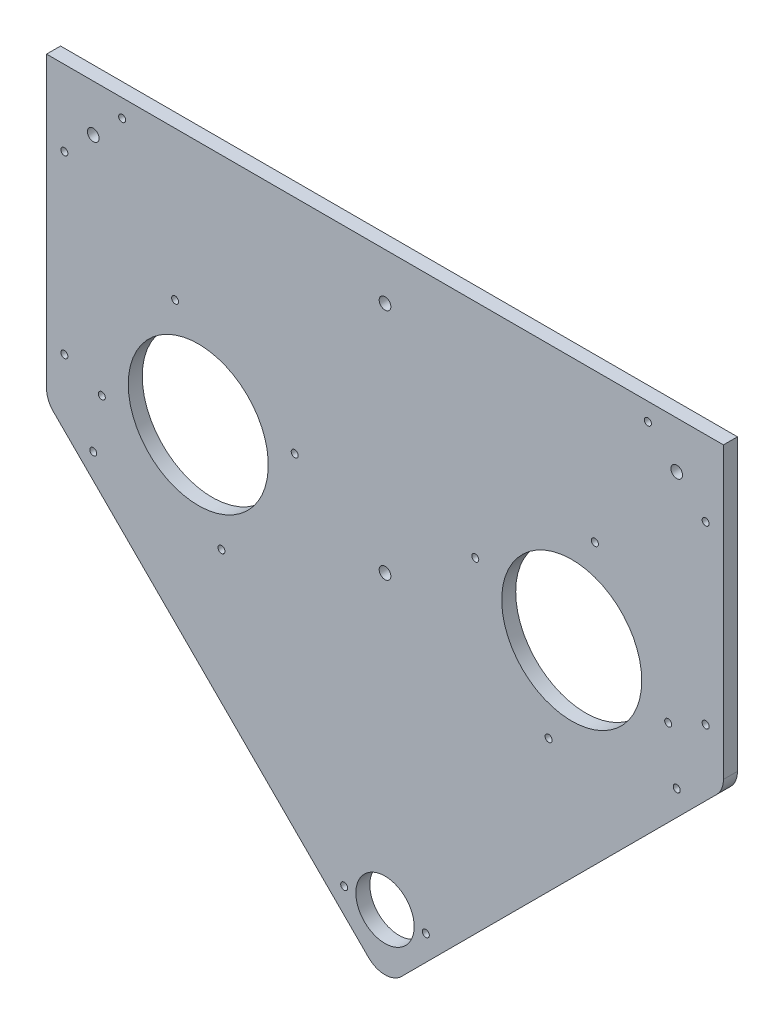
from build123d import *

# Parameters (mm, degrees)
SKETCH1_R           = 12.5
SKETCH1_R_2         = 1.5
SKETCH1_R_3         = 2.5
BOSS_EXTRUDE1_DEPTH = 6
FILLET1_R           = 10
SKETCH2_R           = 1.5
SKETCH2_R_2         = 30
CUT_EXTRUDE1_DEPTH  = 10


with BuildPart() as part:
    # Sketch1 → Boss-Extrude1 (new body)
    with BuildSketch(Plane.XY):
        Polygon((-145, 120), (145, 120), (145, -8.284271247), (0, -153.284271247), (-145, -8.284271247), align=None)
        with Locations((0, -125)):
            Circle(SKETCH1_R, mode=Mode.SUBTRACT)
        with Locations((-137.374368671, 87.625631329)):
            Circle(SKETCH1_R_2, mode=Mode.SUBTRACT)
        with Locations((-112.625631329, 112.374368671)):
            Circle(SKETCH1_R_2, mode=Mode.SUBTRACT)
        with Locations((-137.374368671, 12.374368671)):
            Circle(SKETCH1_R_2, mode=Mode.SUBTRACT)
        with Locations((-125, -17.5)):
            Circle(SKETCH1_R_2, mode=Mode.SUBTRACT)
        with Locations((-17.5, -125)):
            Circle(SKETCH1_R_2, mode=Mode.SUBTRACT)
        with Locations(Location((17.5, -125, 0), (0, 0, 180))):
            Circle(SKETCH1_R_2, mode=Mode.SUBTRACT)
        with Locations(Location((125, -17.5, 0), (0, 0, 180))):
            Circle(SKETCH1_R_2, mode=Mode.SUBTRACT)
        with Locations(Location((137.374368671, 12.374368671, 0), (0, 0, 180))):
            Circle(SKETCH1_R_2, mode=Mode.SUBTRACT)
        with Locations(Location((137.374368671, 87.625631329, 0), (0, 0, 180))):
            Circle(SKETCH1_R_2, mode=Mode.SUBTRACT)
        with Locations(Location((112.625631329, 112.374368671, 0), (0, 0, 180))):
            Circle(SKETCH1_R_2, mode=Mode.SUBTRACT)
        with Locations((0, 100)):
            Circle(SKETCH1_R_3, mode=Mode.SUBTRACT)
        with Locations((-125, 100)):
            Circle(SKETCH1_R_3, mode=Mode.SUBTRACT)
        with Locations((125, 100)):
            Circle(SKETCH1_R_3, mode=Mode.SUBTRACT)
        Circle(SKETCH1_R_3, mode=Mode.SUBTRACT)
    extrude(amount=BOSS_EXTRUDE1_DEPTH)

    # Fillet1
    fillet1_edges = [part.edges().sort_by_distance(p)[0] for p in [
        (145, -8.284271247, 3),
        (0, -153.284271247, 3),
        (-145, -8.284271247, 3),
    ]]
    fillet(fillet1_edges, radius=FILLET1_R)

    # Sketch2 → Cut-Extrude1 (cut)
    with BuildSketch(Plane.XY.offset(6)):
        with Locations((38.67402397, 24.920368197)):
            Circle(SKETCH2_R)
        with Locations((89.920368197, 56.32597603)):
            Circle(SKETCH2_R)
        with Locations((121.32597603, 5.079631803)):
            Circle(SKETCH2_R)
        with Locations((70.079631803, -26.32597603)):
            Circle(SKETCH2_R)
        with Locations((80, 15)):
            Circle(SKETCH2_R_2)
        with Locations(Location((-38.67402397, 24.920368197, 0), (0, 0, 180))):
            Circle(SKETCH2_R)
        with Locations(Location((-89.920368197, 56.32597603, 0), (0, 0, 180))):
            Circle(SKETCH2_R)
        with Locations(Location((-70.079631803, -26.32597603, 0), (0, 0, 180))):
            Circle(SKETCH2_R)
        with Locations(Location((-121.32597603, 5.079631803, 0), (0, 0, 180))):
            Circle(SKETCH2_R)
        with Locations(Location((-80, 15, 0), (0, 0, 180))):
            Circle(SKETCH2_R_2)
    extrude(amount=-CUT_EXTRUDE1_DEPTH, mode=Mode.SUBTRACT)


solid = part.part
